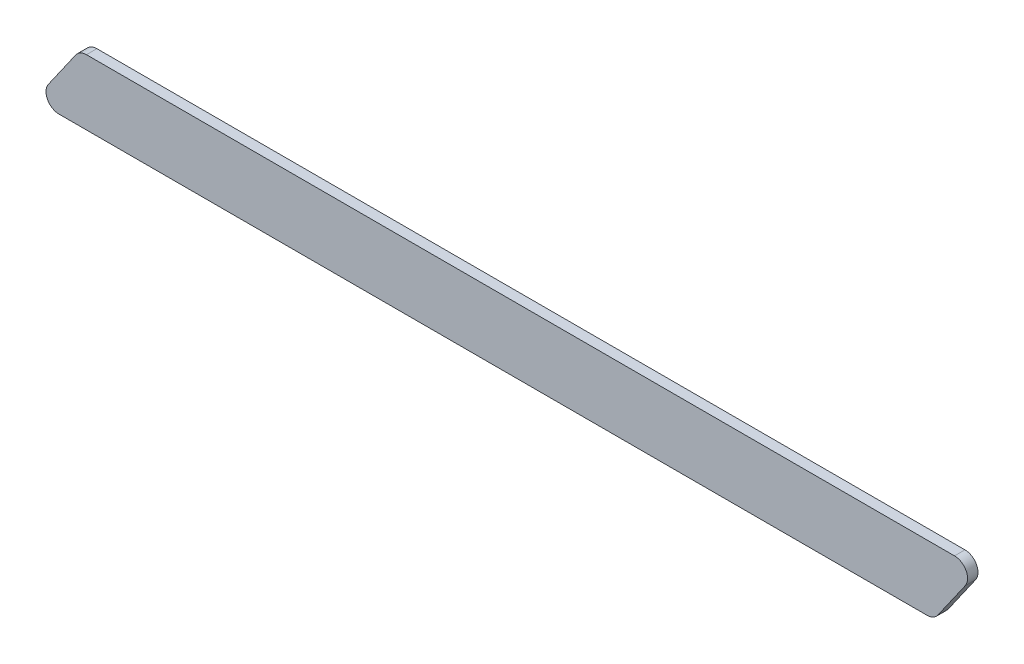
from build123d import *

# Parameters (mm, degrees)
SKETCH1_W           = 145
SKETCH1_H           = 10
BOSS_EXTRUDE1_DEPTH = 1.6
CUT_EXTRUDE1_DEPTH  = 73.68982047
FILLET2_R           = 2


with BuildPart() as part:
    # Sketch1 → Boss-Extrude1 (new body)
    with BuildSketch(Plane.XY):
        Rectangle(SKETCH1_W, SKETCH1_H)
    extrude(amount=BOSS_EXTRUDE1_DEPTH)

    # Sketch2 → Cut-Extrude1 (cut, through all)
    with BuildSketch(Plane.XY.offset(1.6)):
        Polygon((-72.5, -5), (-65.5, 5), (-72.5, 5), align=None)
        Polygon((72.5, 5), (65.5, -5), (72.5, -5), align=None)
    extrude(amount=-CUT_EXTRUDE1_DEPTH, mode=Mode.SUBTRACT)

    # Fillet2
    fillet2_edges = [part.edges().sort_by_distance(p)[0] for p in [
        (72.5, 5, 0.8),
        (65.5, -5, 0.8),
        (-72.5, -5, 0.8),
        (-65.5, 5, 0.8),
    ]]
    fillet(fillet2_edges, radius=FILLET2_R)


solid = part.part
